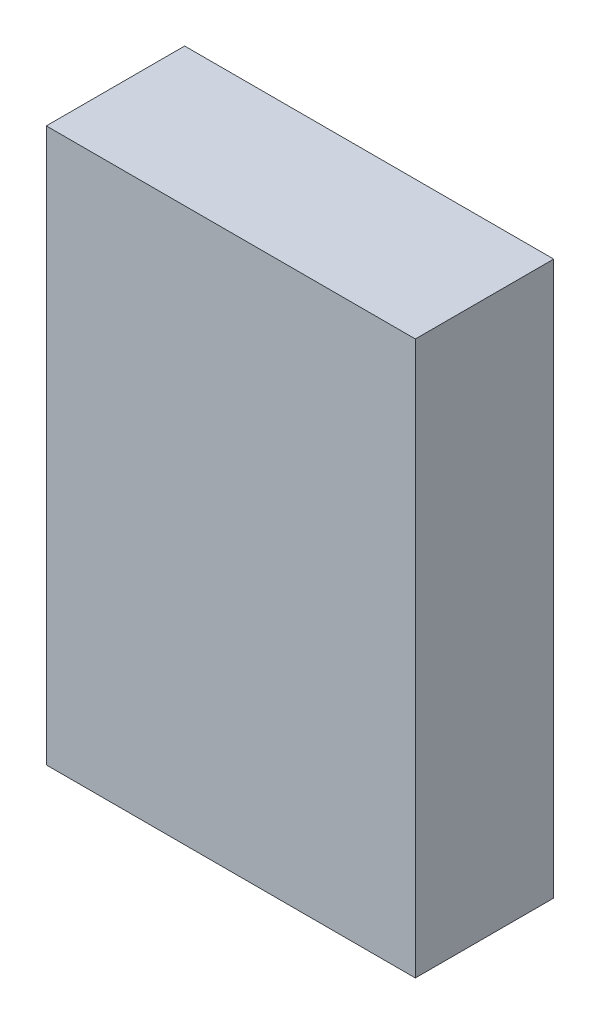
from build123d import *

# Parameters (mm, degrees)
SKETCH_1_W      = 1219
SKETCH_1_H      = 457
EXTRUDE_1_DEPTH = 1828


with BuildPart() as part:
    # 스케치1 → 보스-돌출1 (new body)
    with BuildSketch(Plane(origin=(0, 0, 0), x_dir=(1, 0, 0), z_dir=(0, 1, 0))):
        Rectangle(SKETCH_1_W, SKETCH_1_H)
    extrude(amount=EXTRUDE_1_DEPTH)


solid = part.part
